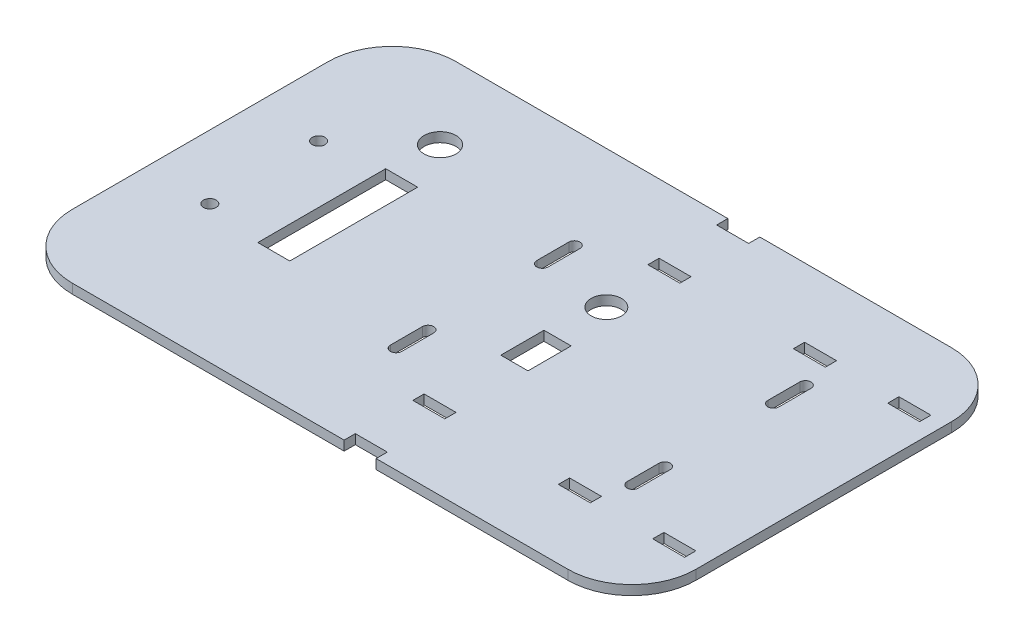
from build123d import *

# Parameters (mm, degrees)
ESBO_O1_W                = 195
ESBO_O1_H                = 120
RESSALTO_EXTRUS_O1_DEPTH = 3
FILETE1_R                = 20
FILETE2_R                = 20
FILETE3_R                = 20
FILETE4_R                = 20
ESBO_O2_W                = 10
ESBO_O2_H                = 3.5
CORTE_EXTRUS_O1_DEPTH    = 229.984715647
CORTE_EXTRUS_O2_DEPTH    = 229.984715647
ESBO_O4_R                = 4.75
ESBO_O4_W                = 8.5
ESBO_O4_H                = 13.5
CORTE_EXTRUS_O3_DEPTH    = 229.984715647
ESBO_O5_R                = 5
ESBO_O5_R_2              = 2
ESBO_O5_W                = 10
ESBO_O5_H                = 40
CORTE_EXTRUS_O4_DEPTH    = 229.984715647


with BuildPart() as part:
    # Esboço1 → Ressalto-extrusão1 (new body)
    with BuildSketch(Plane(origin=(0, 0, 0), x_dir=(1, 0, 0), z_dir=(0, 1, 0))):
        with Locations((97.5, 60)):
            Rectangle(ESBO_O1_W, ESBO_O1_H)
    extrude(amount=RESSALTO_EXTRUS_O1_DEPTH)

    # Filete1
    filete1_edges = [part.edges().sort_by_distance(p)[0] for p in [
        (0, 1.5, 0),
    ]]
    fillet(filete1_edges, radius=FILETE1_R)

    # Filete2
    filete2_edges = [part.edges().sort_by_distance(p)[0] for p in [
        (195, 1.5, 0),
    ]]
    fillet(filete2_edges, radius=FILETE2_R)

    # Filete3
    filete3_edges = [part.edges().sort_by_distance(p)[0] for p in [
        (195, 1.5, -120),
    ]]
    fillet(filete3_edges, radius=FILETE3_R)

    # Filete4
    filete4_edges = [part.edges().sort_by_distance(p)[0] for p in [
        (0, 1.5, -120),
    ]]
    fillet(filete4_edges, radius=FILETE4_R)

    # Esboço2 → Corte-extrusão1 (cut, through all)
    with BuildSketch(Plane(origin=(0, 3, 0), x_dir=(1, 0, 0), z_dir=(0, 1, 0))):
        with Locations((110, 1.75)):
            Rectangle(ESBO_O2_W, ESBO_O2_H)
        with Locations((110, 118.25)):
            Rectangle(ESBO_O2_W, ESBO_O2_H)
        with Locations((110, 23.25)):
            Rectangle(ESBO_O2_W, ESBO_O2_H)
        with Locations((110, 96.75)):
            Rectangle(ESBO_O2_W, ESBO_O2_H)
        with Locations((155.5, 23.25)):
            Rectangle(ESBO_O2_W, ESBO_O2_H)
        with Locations((185, 23.25)):
            Rectangle(ESBO_O2_W, ESBO_O2_H)
        with Locations((155.5, 96.75)):
            Rectangle(ESBO_O2_W, ESBO_O2_H)
        with Locations((185, 96.75)):
            Rectangle(ESBO_O2_W, ESBO_O2_H)
    extrude(amount=-CORTE_EXTRUS_O1_DEPTH, mode=Mode.SUBTRACT)

    # Esboço3 → Corte-extrusão2 (cut, through all)
    with BuildSketch(Plane(origin=(0, 3, 0), x_dir=(1, 0, 0), z_dir=(0, 1, 0))):
        with BuildLine():
            Line((164, 87), (164, 77))
            ThreePointArc((164, 77), (162.25, 75.25), (160.5, 77))
            Line((160.5, 77), (160.5, 87))
            ThreePointArc((160.5, 87), (162.25, 88.75), (164, 87))
        make_face()
        with BuildLine():
            Line((164, 43), (164, 33))
            ThreePointArc((164, 33), (162.25, 31.25), (160.5, 33))
            Line((160.5, 33), (160.5, 43))
            ThreePointArc((160.5, 43), (162.25, 44.75), (164, 43))
        make_face()
        with BuildLine():
            Line((90, 43), (90, 33))
            ThreePointArc((90, 33), (88.25, 31.25), (86.5, 33))
            Line((86.5, 33), (86.5, 43))
            ThreePointArc((86.5, 43), (88.25, 44.75), (90, 43))
        make_face()
        with BuildLine():
            Line((90, 88.75), (90, 78.75))
            ThreePointArc((90, 78.75), (88.25, 77), (86.5, 78.75))
            Line((86.5, 78.75), (86.5, 88.75))
            ThreePointArc((86.5, 88.75), (88.25, 90.5), (90, 88.75))
        make_face()
    extrude(amount=-CORTE_EXTRUS_O2_DEPTH, mode=Mode.SUBTRACT)

    # Esboço4 → Corte-extrusão3 (cut, through all)
    with BuildSketch(Plane(origin=(0, 3, 0), x_dir=(1, 0, 0), z_dir=(0, 1, 0))):
        with Locations(Location((110, 77, 0), (0, 0, 270))):
            Circle(ESBO_O4_R)
        with Locations((110.75, 54.25)):
            Rectangle(ESBO_O4_W, ESBO_O4_H)
    extrude(amount=-CORTE_EXTRUS_O3_DEPTH, mode=Mode.SUBTRACT)

    # Esboço5 → Corte-extrusão4 (cut, through all)
    with BuildSketch(Plane(origin=(0, 3, 0), x_dir=(1, 0, 0), z_dir=(0, 1, 0))):
        with Locations(Location((40, 95, 0), (0, 0, 270))):
            Circle(ESBO_O5_R)
        with Locations(Location((20, 77, 0), (0, 0, 270))):
            Circle(ESBO_O5_R_2)
        with Locations(Location((20, 43, 0), (0, 0, 270))):
            Circle(ESBO_O5_R_2)
        with Locations((43, 60)):
            Rectangle(ESBO_O5_W, ESBO_O5_H)
    extrude(amount=-CORTE_EXTRUS_O4_DEPTH, mode=Mode.SUBTRACT)


solid = part.part
